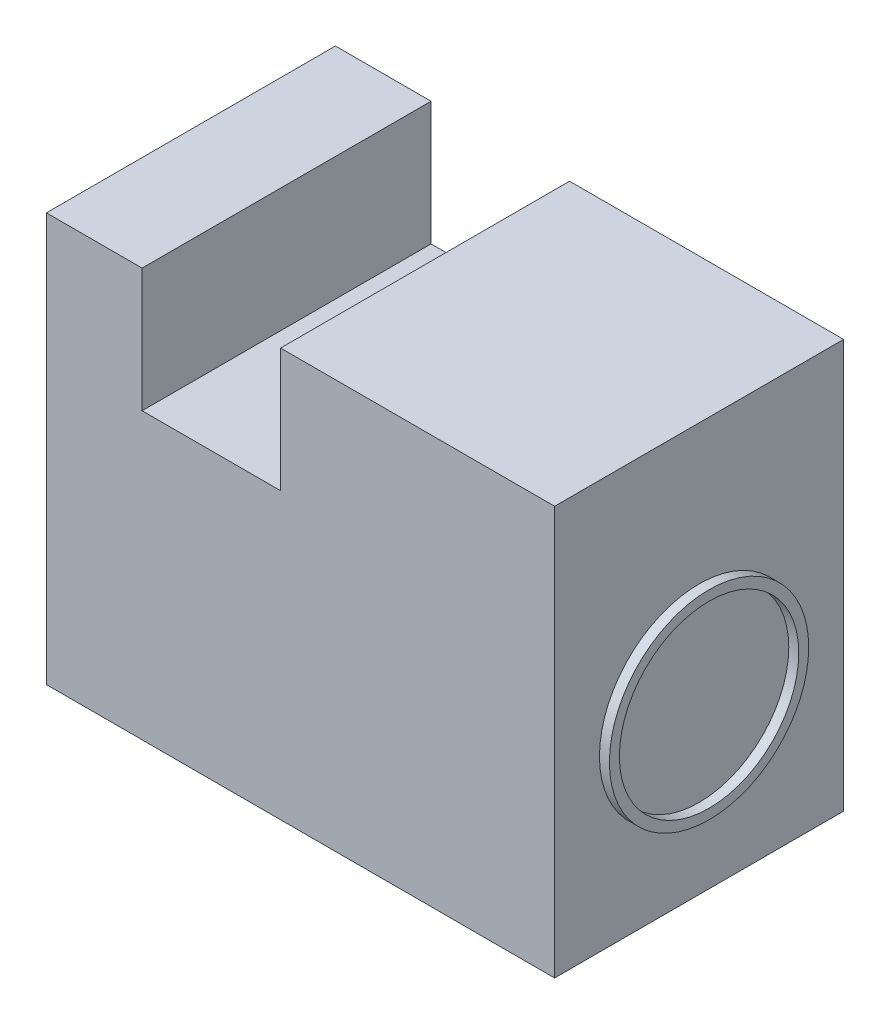
from build123d import *

# Parameters (mm, degrees)
SKETCH1_W           = 51
SKETCH1_H           = 29
BOSS_EXTRUDE1_DEPTH = 41
SKETCH2_R           = 10
SKETCH2_R_2         = 9
BOSS_EXTRUDE2_DEPTH = 1
SKETCH3_W           = 13.9
SKETCH3_H           = 12.4
CUT_EXTRUDE1_DEPTH  = 57.782479692
SKETCH4_R           = 1.5
CUT_EXTRUDE2_DEPTH  = 5


with BuildPart() as part:
    # Sketch1 → Boss-Extrude1 (new body)
    with BuildSketch(Plane(origin=(0, 0, 0), x_dir=(1, 0, 0), z_dir=(0, 1, 0))):
        Rectangle(SKETCH1_W, SKETCH1_H)
    extrude(amount=BOSS_EXTRUDE1_DEPTH)

    # Sketch2 → Boss-Extrude2 (add)
    with BuildSketch(Plane(origin=(25.5, 0, 0), x_dir=(0, 0, -1), z_dir=(1, 0, 0))):
        with Locations(Location((0, 17, 0), (0, 0, 180))):
            Circle(SKETCH2_R)
        with Locations((0, 17)):
            Circle(SKETCH2_R_2, mode=Mode.SUBTRACT)
    extrude(amount=BOSS_EXTRUDE2_DEPTH)

    # Sketch3 → Cut-Extrude1 (cut, through all)
    with BuildSketch(Plane.XY.offset(14.5)):
        with Locations((-8.95, 34.8)):
            Rectangle(SKETCH3_W, SKETCH3_H)
    extrude(amount=-CUT_EXTRUDE1_DEPTH, mode=Mode.SUBTRACT)

    # Sketch4 → Cut-Extrude2 (cut)
    with BuildSketch(Plane(origin=(0, 0, -14.5), x_dir=(-1, 0, 0), z_dir=(0, 0, -1))):
        with Locations((-18.5, 34)):
            Circle(SKETCH4_R)
        with Locations((18.5, 7)):
            Circle(SKETCH4_R)
    extrude(amount=-CUT_EXTRUDE2_DEPTH, mode=Mode.SUBTRACT)


solid = part.part
